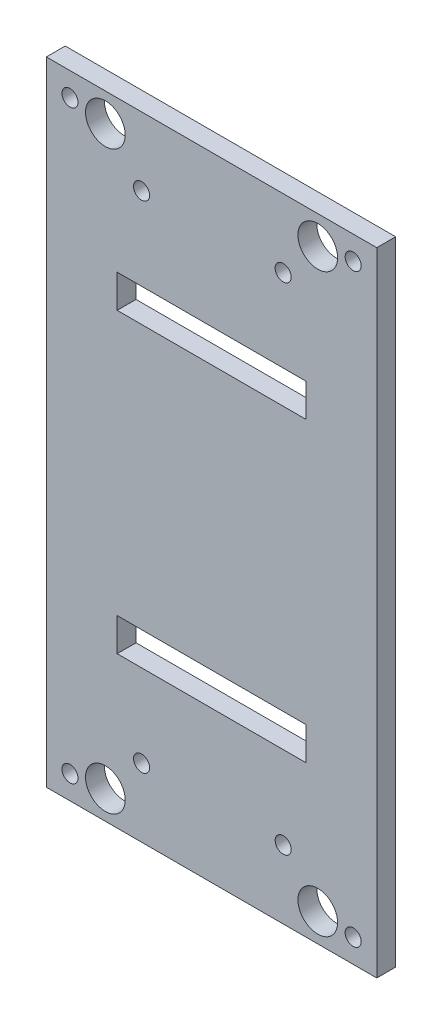
from build123d import *

# Parameters (mm, degrees)
CONTROLLER_REMOVABLE_CENTRAL_TRAY_START   = 57
SKETCH_1_W                                = 70
SKETCH_1_H                                = 134
CONTROLLER_REMOVABLE_CENTRAL_TRAY_DEPTH   = 4
CONTROLLER_FLANGE_AND_SERVICE_SLOTS_START = 62
SKETCH_2_R                                = 1.7
SKETCH_2_W                                = 40
SKETCH_2_H                                = 7
CONTROLLER_FLANGE_AND_SERVICE_SLOTS_DEPTH = 6
DRIVER_POST_AND_FASTENER_CLEARANCE_START  = 62
SKETCH_3_R                                = 4.2
DRIVER_POST_AND_FASTENER_CLEARANCE_DEPTH  = 6


with BuildPart() as part:
    # 草图1 → Controller_removable_central_tray (new body)
    with BuildSketch(Plane.XY.offset(CONTROLLER_REMOVABLE_CENTRAL_TRAY_START)):
        Rectangle(SKETCH_1_W, SKETCH_1_H)
    extrude(amount=CONTROLLER_REMOVABLE_CENTRAL_TRAY_DEPTH)

    # 草图2 → Controller_flange_and_service_slots (cut)
    with BuildSketch(Plane.XY.offset(CONTROLLER_FLANGE_AND_SERVICE_SLOTS_START)):
        with Locations(Location((-30, -62, 0), (0, 0, 180))):
            Circle(SKETCH_2_R)
        with Locations(Location((-30, 62, 0), (0, 0, 180))):
            Circle(SKETCH_2_R)
        with Locations(Location((30, -62, 0), (0, 0, 180))):
            Circle(SKETCH_2_R)
        with Locations(Location((30, 62, 0), (0, 0, 180))):
            Circle(SKETCH_2_R)
        with Locations(Location((15.172281679, -52.5, 0), (0, 0, 180))):
            Circle(SKETCH_2_R)
        with Locations(Location((15.172281679, 52.5, 0), (0, 0, 180))):
            Circle(SKETCH_2_R)
        with Locations(Location((-14.827718321, -52.5, 0), (0, 0, 180))):
            Circle(SKETCH_2_R)
        with Locations(Location((-14.827718321, 52.5, 0), (0, 0, 180))):
            Circle(SKETCH_2_R)
        with Locations((0, -31.5)):
            Rectangle(SKETCH_2_W, SKETCH_2_H)
        with Locations((0, 31.5)):
            Rectangle(SKETCH_2_W, SKETCH_2_H)
    extrude(amount=-CONTROLLER_FLANGE_AND_SERVICE_SLOTS_DEPTH, mode=Mode.SUBTRACT)

    # 草图3 → Driver_post_and_fastener_clearance (cut)
    with BuildSketch(Plane.XY.offset(DRIVER_POST_AND_FASTENER_CLEARANCE_START)):
        with Locations(Location((-22.5, -61, 0), (0, 0, 180))):
            Circle(SKETCH_3_R)
        with Locations(Location((-22.5, 61, 0), (0, 0, 180))):
            Circle(SKETCH_3_R)
        with Locations(Location((22.5, -61, 0), (0, 0, 180))):
            Circle(SKETCH_3_R)
        with Locations(Location((22.5, 61, 0), (0, 0, 180))):
            Circle(SKETCH_3_R)
    extrude(amount=-DRIVER_POST_AND_FASTENER_CLEARANCE_DEPTH, mode=Mode.SUBTRACT)


solid = part.part
